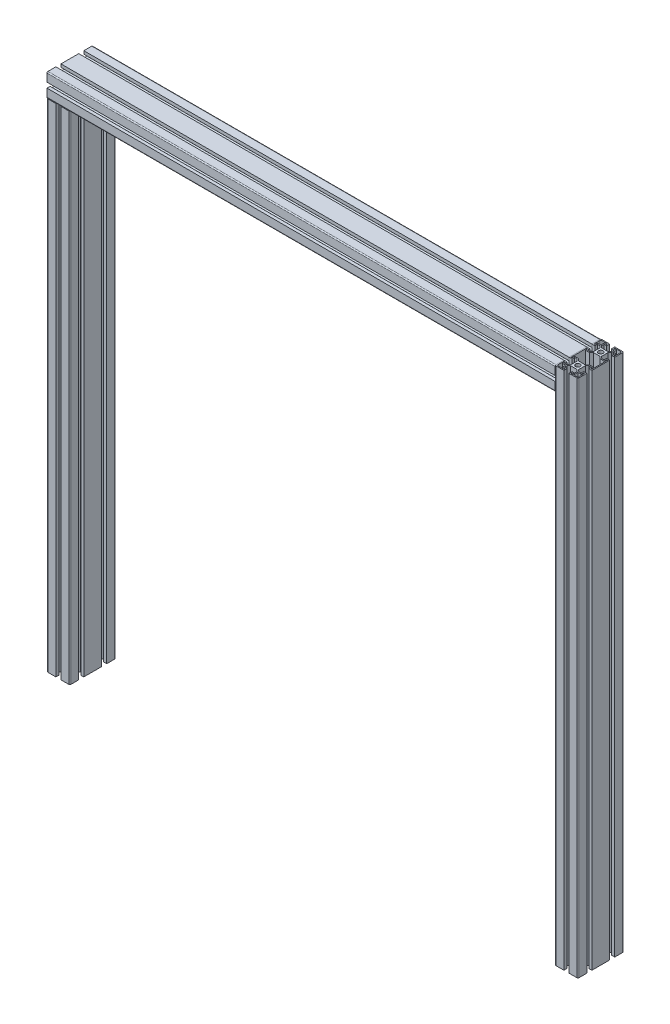
from build123d import *

# Parameters (mm, degrees)
PERFIL_ALUMINIO_45_X_90_1_DEPTH      = 1000
PERFIL_ALUMINIO_45_X_90_1_DEPTH_BACK = 22.5
SKETCH1_R                            = 4.5
SKETCH1_ON_SEGMENT_2_R               = 4.5
PERFIL_ALUMINIO_45_X_90_1_2_DEPTH    = 1022.5
SKETCH1_ON_SEGMENT_3_R               = 4.5
PERFIL_ALUMINIO_45_X_90_1_3_DEPTH    = 1002
BODY_START                           = 23.5
BODY_3_RUN_ON_DEPTH                  = 45


with BuildPart() as part:
    # Sketch1 → Perfil aluminio 45 X 90(1) (new, two sides: drawn at the far end of the back side and taken through both)
    with BuildSketch(Plane(origin=(1000, 1000, 0), x_dir=(1, 0, 0), z_dir=(0, -1, 0)).offset(-PERFIL_ALUMINIO_45_X_90_1_DEPTH_BACK)):
        with BuildLine():
            Line((-16.5, -27.5), (-22.5, -27.5))
            Line((-22.5, -27.5), (-22.5, -43))
            ThreePointArc((-22.5, -43), (-21.914213562, -44.414213562), (-20.5, -45))
            Line((-20.5, -45), (-5, -45))
            Line((-5, -45), (-5, -39))
            Line((-5, -39), (-10, -39))
            Line((-10, -39), (-10, -33.914213562))
            Line((-10, -33.914213562), (-6.585786438, -30.5))
            Line((-6.585786438, -30.5), (6.585786438, -30.5))
            Line((6.585786438, -30.5), (10, -33.914213562))
            Line((10, -33.914213562), (10, -39))
            Line((10, -39), (5, -39))
            Line((5, -39), (5, -45))
            Line((5, -45), (20.5, -45))
            ThreePointArc((20.5, -45), (21.914213562, -44.414213562), (22.5, -43))
            Line((22.5, -43), (22.5, -27.5))
            Line((22.5, -27.5), (16.5, -27.5))
            Line((16.5, -27.5), (16.5, -32.5))
            Line((16.5, -32.5), (11.414213562, -32.5))
            Line((11.414213562, -32.5), (8, -29.085786438))
            Line((8, -29.085786438), (8, -15.914213562))
            Line((8, -15.914213562), (11.414213562, -12.5))
            Line((11.414213562, -12.5), (16.5, -12.5))
            Line((16.5, -12.5), (16.5, -17.5))
            Line((16.5, -17.5), (22.5, -17.5))
            Line((22.5, -17.5), (22.5, 17.5))
            Line((22.5, 17.5), (16.5, 17.5))
            Line((16.5, 17.5), (16.5, 12.5))
            Line((16.5, 12.5), (11.414213562, 12.5))
            Line((11.414213562, 12.5), (8, 15.914213562))
            Line((8, 15.914213562), (8, 29.085786438))
            Line((8, 29.085786438), (11.414213562, 32.5))
            Line((11.414213562, 32.5), (16.5, 32.5))
            Line((16.5, 32.5), (16.5, 27.5))
            Line((16.5, 27.5), (22.5, 27.5))
            Line((22.5, 27.5), (22.5, 43))
            ThreePointArc((22.5, 43), (21.914213562, 44.414213562), (20.5, 45))
            Line((20.5, 45), (5, 45))
            Line((5, 45), (5, 39))
            Line((5, 39), (10, 39))
            Line((10, 39), (10, 33.914213562))
            Line((10, 33.914213562), (6.585786438, 30.5))
            Line((6.585786438, 30.5), (-6.585786438, 30.5))
            Line((-6.585786438, 30.5), (-10, 33.914213562))
            Line((-10, 33.914213562), (-10, 39))
            Line((-10, 39), (-5, 39))
            Line((-5, 39), (-5, 45))
            Line((-5, 45), (-20.5, 45))
            ThreePointArc((-20.5, 45), (-21.914213562, 44.414213562), (-22.5, 43))
            Line((-22.5, 43), (-22.5, 27.5))
            Line((-22.5, 27.5), (-16.5, 27.5))
            Line((-16.5, 27.5), (-16.5, 32.5))
            Line((-16.5, 32.5), (-11.414213562, 32.5))
            Line((-11.414213562, 32.5), (-8, 29.085786438))
            Line((-8, 29.085786438), (-8, 15.914213562))
            Line((-8, 15.914213562), (-11.414213562, 12.5))
            Line((-11.414213562, 12.5), (-16.5, 12.5))
            Line((-16.5, 12.5), (-16.5, 17.5))
            Line((-16.5, 17.5), (-22.5, 17.5))
            Line((-22.5, 17.5), (-22.5, -17.5))
            Line((-22.5, -17.5), (-16.5, -17.5))
            Line((-16.5, -17.5), (-16.5, -12.5))
            Line((-16.5, -12.5), (-11.414213562, -12.5))
            Line((-11.414213562, -12.5), (-8, -15.914213562))
            Line((-8, -15.914213562), (-8, -29.085786438))
            Line((-8, -29.085786438), (-11.414213562, -32.5))
            Line((-11.414213562, -32.5), (-16.5, -32.5))
            Line((-16.5, -32.5), (-16.5, -27.5))
        make_face()
        with Locations((0, -22.5)):
            Circle(SKETCH1_R, mode=Mode.SUBTRACT)
        with Locations((0, 22.5)):
            Circle(SKETCH1_R, mode=Mode.SUBTRACT)
        with BuildLine():
            Line((-20.5, -29.5), (-20.5, -41))
            ThreePointArc((-20.5, -41), (-19.914213562, -42.414213562), (-18.5, -43))
            Line((-18.5, -43), (-7, -43))
            Line((-7, -43), (-7, -41))
            Line((-7, -41), (-12, -41))
            Line((-12, -41), (-12, -34.5))
            Line((-12, -34.5), (-18.5, -34.5))
            Line((-18.5, -34.5), (-18.5, -29.5))
            Line((-18.5, -29.5), (-20.5, -29.5))
        make_face(mode=Mode.SUBTRACT)
        with BuildLine():
            Line((12, -41), (12, -34.5))
            Line((12, -34.5), (18.5, -34.5))
            Line((18.5, -34.5), (18.5, -29.5))
            Line((18.5, -29.5), (20.5, -29.5))
            Line((20.5, -29.5), (20.5, -41))
            ThreePointArc((20.5, -41), (19.914213562, -42.414213562), (18.5, -43))
            Line((18.5, -43), (7, -43))
            Line((7, -43), (7, -41))
            Line((7, -41), (12, -41))
        make_face(mode=Mode.SUBTRACT)
        Polygon((20.5, -2), (20.5, 2), (20.5, 15.5), (18.5, 15.5), (18.5, 10.5), (12, 10.5), (10.585786438, 10.5), (10, 11.085786438), (6.585786438, 14.5), (-6.585786438, 14.5), (-10, 11.085786438), (-10.585786438, 10.5), (-12, 10.5), (-18.5, 10.5), (-18.5, 15.5), (-20.5, 15.5), (-20.5, 2), (-20.5, -2), (-20.5, -15.5), (-18.5, -15.5), (-18.5, -10.5), (-12, -10.5), (-10.585786438, -10.5), (-10, -11.085786438), (-6.585786438, -14.5), (6.585786438, -14.5), (10, -11.085786438), (10.585786438, -10.5), (12, -10.5), (18.5, -10.5), (18.5, -15.5), (20.5, -15.5), align=None, mode=Mode.SUBTRACT)
        with BuildLine():
            Line((-12, 41), (-12, 34.5))
            Line((-12, 34.5), (-18.5, 34.5))
            Line((-18.5, 34.5), (-18.5, 29.5))
            Line((-18.5, 29.5), (-20.5, 29.5))
            Line((-20.5, 29.5), (-20.5, 41))
            ThreePointArc((-20.5, 41), (-19.914213562, 42.414213562), (-18.5, 43))
            Line((-18.5, 43), (-7, 43))
            Line((-7, 43), (-7, 41))
            Line((-7, 41), (-12, 41))
        make_face(mode=Mode.SUBTRACT)
        with BuildLine():
            Line((20.5, 29.5), (20.5, 41))
            ThreePointArc((20.5, 41), (19.914213562, 42.414213562), (18.5, 43))
            Line((18.5, 43), (7, 43))
            Line((7, 43), (7, 41))
            Line((7, 41), (12, 41))
            Line((12, 41), (12, 34.5))
            Line((12, 34.5), (18.5, 34.5))
            Line((18.5, 34.5), (18.5, 29.5))
            Line((18.5, 29.5), (20.5, 29.5))
        make_face(mode=Mode.SUBTRACT)
    extrude(amount=PERFIL_ALUMINIO_45_X_90_1_DEPTH + PERFIL_ALUMINIO_45_X_90_1_DEPTH_BACK)


with BuildPart() as body_2:
    # Sketch1 on segment 2 (carried to segment 2) → Perfil aluminio 45 X 90_1 2 (new body)
    with BuildSketch(Plane.XZ.offset(-1022.5)):
        with BuildLine():
            Line((-16.5, -27.5), (-22.5, -27.5))
            Line((-22.5, -27.5), (-22.5, -43))
            ThreePointArc((-22.5, -43), (-21.914213562, -44.414213562), (-20.5, -45))
            Line((-20.5, -45), (-5, -45))
            Line((-5, -45), (-5, -39))
            Line((-5, -39), (-10, -39))
            Line((-10, -39), (-10, -33.914213562))
            Line((-10, -33.914213562), (-6.585786438, -30.5))
            Line((-6.585786438, -30.5), (6.585786438, -30.5))
            Line((6.585786438, -30.5), (10, -33.914213562))
            Line((10, -33.914213562), (10, -39))
            Line((10, -39), (5, -39))
            Line((5, -39), (5, -45))
            Line((5, -45), (20.5, -45))
            ThreePointArc((20.5, -45), (21.914213562, -44.414213562), (22.5, -43))
            Line((22.5, -43), (22.5, -27.5))
            Line((22.5, -27.5), (16.5, -27.5))
            Line((16.5, -27.5), (16.5, -32.5))
            Line((16.5, -32.5), (11.414213562, -32.5))
            Line((11.414213562, -32.5), (8, -29.085786438))
            Line((8, -29.085786438), (8, -15.914213562))
            Line((8, -15.914213562), (11.414213562, -12.5))
            Line((11.414213562, -12.5), (16.5, -12.5))
            Line((16.5, -12.5), (16.5, -17.5))
            Line((16.5, -17.5), (22.5, -17.5))
            Line((22.5, -17.5), (22.5, 17.5))
            Line((22.5, 17.5), (16.5, 17.5))
            Line((16.5, 17.5), (16.5, 12.5))
            Line((16.5, 12.5), (11.414213562, 12.5))
            Line((11.414213562, 12.5), (8, 15.914213562))
            Line((8, 15.914213562), (8, 29.085786438))
            Line((8, 29.085786438), (11.414213562, 32.5))
            Line((11.414213562, 32.5), (16.5, 32.5))
            Line((16.5, 32.5), (16.5, 27.5))
            Line((16.5, 27.5), (22.5, 27.5))
            Line((22.5, 27.5), (22.5, 43))
            ThreePointArc((22.5, 43), (21.914213562, 44.414213562), (20.5, 45))
            Line((20.5, 45), (5, 45))
            Line((5, 45), (5, 39))
            Line((5, 39), (10, 39))
            Line((10, 39), (10, 33.914213562))
            Line((10, 33.914213562), (6.585786438, 30.5))
            Line((6.585786438, 30.5), (-6.585786438, 30.5))
            Line((-6.585786438, 30.5), (-10, 33.914213562))
            Line((-10, 33.914213562), (-10, 39))
            Line((-10, 39), (-5, 39))
            Line((-5, 39), (-5, 45))
            Line((-5, 45), (-20.5, 45))
            ThreePointArc((-20.5, 45), (-21.914213562, 44.414213562), (-22.5, 43))
            Line((-22.5, 43), (-22.5, 27.5))
            Line((-22.5, 27.5), (-16.5, 27.5))
            Line((-16.5, 27.5), (-16.5, 32.5))
            Line((-16.5, 32.5), (-11.414213562, 32.5))
            Line((-11.414213562, 32.5), (-8, 29.085786438))
            Line((-8, 29.085786438), (-8, 15.914213562))
            Line((-8, 15.914213562), (-11.414213562, 12.5))
            Line((-11.414213562, 12.5), (-16.5, 12.5))
            Line((-16.5, 12.5), (-16.5, 17.5))
            Line((-16.5, 17.5), (-22.5, 17.5))
            Line((-22.5, 17.5), (-22.5, -17.5))
            Line((-22.5, -17.5), (-16.5, -17.5))
            Line((-16.5, -17.5), (-16.5, -12.5))
            Line((-16.5, -12.5), (-11.414213562, -12.5))
            Line((-11.414213562, -12.5), (-8, -15.914213562))
            Line((-8, -15.914213562), (-8, -29.085786438))
            Line((-8, -29.085786438), (-11.414213562, -32.5))
            Line((-11.414213562, -32.5), (-16.5, -32.5))
            Line((-16.5, -32.5), (-16.5, -27.5))
        make_face()
        with Locations((0, -22.5)):
            Circle(SKETCH1_ON_SEGMENT_2_R, mode=Mode.SUBTRACT)
        with Locations((0, 22.5)):
            Circle(SKETCH1_ON_SEGMENT_2_R, mode=Mode.SUBTRACT)
        with BuildLine():
            Line((-20.5, -29.5), (-20.5, -41))
            ThreePointArc((-20.5, -41), (-19.914213562, -42.414213562), (-18.5, -43))
            Line((-18.5, -43), (-7, -43))
            Line((-7, -43), (-7, -41))
            Line((-7, -41), (-12, -41))
            Line((-12, -41), (-12, -34.5))
            Line((-12, -34.5), (-18.5, -34.5))
            Line((-18.5, -34.5), (-18.5, -29.5))
            Line((-18.5, -29.5), (-20.5, -29.5))
        make_face(mode=Mode.SUBTRACT)
        with BuildLine():
            Line((12, -41), (12, -34.5))
            Line((12, -34.5), (18.5, -34.5))
            Line((18.5, -34.5), (18.5, -29.5))
            Line((18.5, -29.5), (20.5, -29.5))
            Line((20.5, -29.5), (20.5, -41))
            ThreePointArc((20.5, -41), (19.914213562, -42.414213562), (18.5, -43))
            Line((18.5, -43), (7, -43))
            Line((7, -43), (7, -41))
            Line((7, -41), (12, -41))
        make_face(mode=Mode.SUBTRACT)
        Polygon((20.5, -2), (20.5, 2), (20.5, 15.5), (18.5, 15.5), (18.5, 10.5), (12, 10.5), (10.585786438, 10.5), (10, 11.085786438), (6.585786438, 14.5), (-6.585786438, 14.5), (-10, 11.085786438), (-10.585786438, 10.5), (-12, 10.5), (-18.5, 10.5), (-18.5, 15.5), (-20.5, 15.5), (-20.5, 2), (-20.5, -2), (-20.5, -15.5), (-18.5, -15.5), (-18.5, -10.5), (-12, -10.5), (-10.585786438, -10.5), (-10, -11.085786438), (-6.585786438, -14.5), (6.585786438, -14.5), (10, -11.085786438), (10.585786438, -10.5), (12, -10.5), (18.5, -10.5), (18.5, -15.5), (20.5, -15.5), align=None, mode=Mode.SUBTRACT)
        with BuildLine():
            Line((-12, 41), (-12, 34.5))
            Line((-12, 34.5), (-18.5, 34.5))
            Line((-18.5, 34.5), (-18.5, 29.5))
            Line((-18.5, 29.5), (-20.5, 29.5))
            Line((-20.5, 29.5), (-20.5, 41))
            ThreePointArc((-20.5, 41), (-19.914213562, 42.414213562), (-18.5, 43))
            Line((-18.5, 43), (-7, 43))
            Line((-7, 43), (-7, 41))
            Line((-7, 41), (-12, 41))
        make_face(mode=Mode.SUBTRACT)
        with BuildLine():
            Line((20.5, 29.5), (20.5, 41))
            ThreePointArc((20.5, 41), (19.914213562, 42.414213562), (18.5, 43))
            Line((18.5, 43), (7, 43))
            Line((7, 43), (7, 41))
            Line((7, 41), (12, 41))
            Line((12, 41), (12, 34.5))
            Line((12, 34.5), (18.5, 34.5))
            Line((18.5, 34.5), (18.5, 29.5))
            Line((18.5, 29.5), (20.5, 29.5))
        make_face(mode=Mode.SUBTRACT)
    extrude(amount=PERFIL_ALUMINIO_45_X_90_1_2_DEPTH)

    # Trim_Extend1 3
    split(bisect_by=Plane(origin=(500, 977.5, 0), x_dir=(1, 0, 0), z_dir=(0, -1, 0)), keep=Keep.TOP)


with BuildPart() as body_3:
    # Sketch1 on segment 3 (carried to segment 3) → Perfil aluminio 45 X 90_1 3 (new body)
    with BuildSketch(Plane(origin=(-1, 1000, 0), x_dir=(0, 1, 0), z_dir=(1, 0, 0))):
        with BuildLine():
            Line((-16.5, -27.5), (-22.5, -27.5))
            Line((-22.5, -27.5), (-22.5, -43))
            ThreePointArc((-22.5, -43), (-21.914213562, -44.414213562), (-20.5, -45))
            Line((-20.5, -45), (-5, -45))
            Line((-5, -45), (-5, -39))
            Line((-5, -39), (-10, -39))
            Line((-10, -39), (-10, -33.914213562))
            Line((-10, -33.914213562), (-6.585786438, -30.5))
            Line((-6.585786438, -30.5), (6.585786438, -30.5))
            Line((6.585786438, -30.5), (10, -33.914213562))
            Line((10, -33.914213562), (10, -39))
            Line((10, -39), (5, -39))
            Line((5, -39), (5, -45))
            Line((5, -45), (20.5, -45))
            ThreePointArc((20.5, -45), (21.914213562, -44.414213562), (22.5, -43))
            Line((22.5, -43), (22.5, -27.5))
            Line((22.5, -27.5), (16.5, -27.5))
            Line((16.5, -27.5), (16.5, -32.5))
            Line((16.5, -32.5), (11.414213562, -32.5))
            Line((11.414213562, -32.5), (8, -29.085786438))
            Line((8, -29.085786438), (8, -15.914213562))
            Line((8, -15.914213562), (11.414213562, -12.5))
            Line((11.414213562, -12.5), (16.5, -12.5))
            Line((16.5, -12.5), (16.5, -17.5))
            Line((16.5, -17.5), (22.5, -17.5))
            Line((22.5, -17.5), (22.5, 17.5))
            Line((22.5, 17.5), (16.5, 17.5))
            Line((16.5, 17.5), (16.5, 12.5))
            Line((16.5, 12.5), (11.414213562, 12.5))
            Line((11.414213562, 12.5), (8, 15.914213562))
            Line((8, 15.914213562), (8, 29.085786438))
            Line((8, 29.085786438), (11.414213562, 32.5))
            Line((11.414213562, 32.5), (16.5, 32.5))
            Line((16.5, 32.5), (16.5, 27.5))
            Line((16.5, 27.5), (22.5, 27.5))
            Line((22.5, 27.5), (22.5, 43))
            ThreePointArc((22.5, 43), (21.914213562, 44.414213562), (20.5, 45))
            Line((20.5, 45), (5, 45))
            Line((5, 45), (5, 39))
            Line((5, 39), (10, 39))
            Line((10, 39), (10, 33.914213562))
            Line((10, 33.914213562), (6.585786438, 30.5))
            Line((6.585786438, 30.5), (-6.585786438, 30.5))
            Line((-6.585786438, 30.5), (-10, 33.914213562))
            Line((-10, 33.914213562), (-10, 39))
            Line((-10, 39), (-5, 39))
            Line((-5, 39), (-5, 45))
            Line((-5, 45), (-20.5, 45))
            ThreePointArc((-20.5, 45), (-21.914213562, 44.414213562), (-22.5, 43))
            Line((-22.5, 43), (-22.5, 27.5))
            Line((-22.5, 27.5), (-16.5, 27.5))
            Line((-16.5, 27.5), (-16.5, 32.5))
            Line((-16.5, 32.5), (-11.414213562, 32.5))
            Line((-11.414213562, 32.5), (-8, 29.085786438))
            Line((-8, 29.085786438), (-8, 15.914213562))
            Line((-8, 15.914213562), (-11.414213562, 12.5))
            Line((-11.414213562, 12.5), (-16.5, 12.5))
            Line((-16.5, 12.5), (-16.5, 17.5))
            Line((-16.5, 17.5), (-22.5, 17.5))
            Line((-22.5, 17.5), (-22.5, -17.5))
            Line((-22.5, -17.5), (-16.5, -17.5))
            Line((-16.5, -17.5), (-16.5, -12.5))
            Line((-16.5, -12.5), (-11.414213562, -12.5))
            Line((-11.414213562, -12.5), (-8, -15.914213562))
            Line((-8, -15.914213562), (-8, -29.085786438))
            Line((-8, -29.085786438), (-11.414213562, -32.5))
            Line((-11.414213562, -32.5), (-16.5, -32.5))
            Line((-16.5, -32.5), (-16.5, -27.5))
        make_face()
        with Locations((0, -22.5)):
            Circle(SKETCH1_ON_SEGMENT_3_R, mode=Mode.SUBTRACT)
        with Locations((0, 22.5)):
            Circle(SKETCH1_ON_SEGMENT_3_R, mode=Mode.SUBTRACT)
        with BuildLine():
            Line((-20.5, -29.5), (-20.5, -41))
            ThreePointArc((-20.5, -41), (-19.914213562, -42.414213562), (-18.5, -43))
            Line((-18.5, -43), (-7, -43))
            Line((-7, -43), (-7, -41))
            Line((-7, -41), (-12, -41))
            Line((-12, -41), (-12, -34.5))
            Line((-12, -34.5), (-18.5, -34.5))
            Line((-18.5, -34.5), (-18.5, -29.5))
            Line((-18.5, -29.5), (-20.5, -29.5))
        make_face(mode=Mode.SUBTRACT)
        with BuildLine():
            Line((12, -41), (12, -34.5))
            Line((12, -34.5), (18.5, -34.5))
            Line((18.5, -34.5), (18.5, -29.5))
            Line((18.5, -29.5), (20.5, -29.5))
            Line((20.5, -29.5), (20.5, -41))
            ThreePointArc((20.5, -41), (19.914213562, -42.414213562), (18.5, -43))
            Line((18.5, -43), (7, -43))
            Line((7, -43), (7, -41))
            Line((7, -41), (12, -41))
        make_face(mode=Mode.SUBTRACT)
        Polygon((20.5, -2), (20.5, 2), (20.5, 15.5), (18.5, 15.5), (18.5, 10.5), (12, 10.5), (10.585786438, 10.5), (10, 11.085786438), (6.585786438, 14.5), (-6.585786438, 14.5), (-10, 11.085786438), (-10.585786438, 10.5), (-12, 10.5), (-18.5, 10.5), (-18.5, 15.5), (-20.5, 15.5), (-20.5, 2), (-20.5, -2), (-20.5, -15.5), (-18.5, -15.5), (-18.5, -10.5), (-12, -10.5), (-10.585786438, -10.5), (-10, -11.085786438), (-6.585786438, -14.5), (6.585786438, -14.5), (10, -11.085786438), (10.585786438, -10.5), (12, -10.5), (18.5, -10.5), (18.5, -15.5), (20.5, -15.5), align=None, mode=Mode.SUBTRACT)
        with BuildLine():
            Line((-12, 41), (-12, 34.5))
            Line((-12, 34.5), (-18.5, 34.5))
            Line((-18.5, 34.5), (-18.5, 29.5))
            Line((-18.5, 29.5), (-20.5, 29.5))
            Line((-20.5, 29.5), (-20.5, 41))
            ThreePointArc((-20.5, 41), (-19.914213562, 42.414213562), (-18.5, 43))
            Line((-18.5, 43), (-7, 43))
            Line((-7, 43), (-7, 41))
            Line((-7, 41), (-12, 41))
        make_face(mode=Mode.SUBTRACT)
        with BuildLine():
            Line((20.5, 29.5), (20.5, 41))
            ThreePointArc((20.5, 41), (19.914213562, 42.414213562), (18.5, 43))
            Line((18.5, 43), (7, 43))
            Line((7, 43), (7, 41))
            Line((7, 41), (12, 41))
            Line((12, 41), (12, 34.5))
            Line((12, 34.5), (18.5, 34.5))
            Line((18.5, 34.5), (18.5, 29.5))
            Line((18.5, 29.5), (20.5, 29.5))
        make_face(mode=Mode.SUBTRACT)
    extrude(amount=PERFIL_ALUMINIO_45_X_90_1_3_DEPTH)

    # Perfil aluminio 45 X 90_1 3 end butt 1
    split(bisect_by=Plane(origin=(22.5, 1000, 0), x_dir=(0, 1, 0), z_dir=(1, 0, 0)), keep=Keep.TOP)

    # Perfil aluminio 45 X 90_1 3 end butt 2
    split(bisect_by=Plane(origin=(977.5, 1000, 0), x_dir=(0, -1, 0), z_dir=(-1, 0, 0)), keep=Keep.TOP)

    # Sketch1 on segment 3 (carried to segment 3) → body 3 run on (add)
    with BuildSketch(Plane(origin=(-1, 1000, 0), x_dir=(0, 1, 0), z_dir=(1, 0, 0)).offset(BODY_START)):
        with BuildLine():
            Line((-16.5, -27.5), (-22.5, -27.5))
            Line((-22.5, -27.5), (-22.5, -43))
            ThreePointArc((-22.5, -43), (-21.914213562, -44.414213562), (-20.5, -45))
            Line((-20.5, -45), (-5, -45))
            Line((-5, -45), (-5, -39))
            Line((-5, -39), (-10, -39))
            Line((-10, -39), (-10, -33.914213562))
            Line((-10, -33.914213562), (-6.585786438, -30.5))
            Line((-6.585786438, -30.5), (6.585786438, -30.5))
            Line((6.585786438, -30.5), (10, -33.914213562))
            Line((10, -33.914213562), (10, -39))
            Line((10, -39), (5, -39))
            Line((5, -39), (5, -45))
            Line((5, -45), (20.5, -45))
            ThreePointArc((20.5, -45), (21.914213562, -44.414213562), (22.5, -43))
            Line((22.5, -43), (22.5, -27.5))
            Line((22.5, -27.5), (16.5, -27.5))
            Line((16.5, -27.5), (16.5, -32.5))
            Line((16.5, -32.5), (11.414213562, -32.5))
            Line((11.414213562, -32.5), (8, -29.085786438))
            Line((8, -29.085786438), (8, -15.914213562))
            Line((8, -15.914213562), (11.414213562, -12.5))
            Line((11.414213562, -12.5), (16.5, -12.5))
            Line((16.5, -12.5), (16.5, -17.5))
            Line((16.5, -17.5), (22.5, -17.5))
            Line((22.5, -17.5), (22.5, 17.5))
            Line((22.5, 17.5), (16.5, 17.5))
            Line((16.5, 17.5), (16.5, 12.5))
            Line((16.5, 12.5), (11.414213562, 12.5))
            Line((11.414213562, 12.5), (8, 15.914213562))
            Line((8, 15.914213562), (8, 29.085786438))
            Line((8, 29.085786438), (11.414213562, 32.5))
            Line((11.414213562, 32.5), (16.5, 32.5))
            Line((16.5, 32.5), (16.5, 27.5))
            Line((16.5, 27.5), (22.5, 27.5))
            Line((22.5, 27.5), (22.5, 43))
            ThreePointArc((22.5, 43), (21.914213562, 44.414213562), (20.5, 45))
            Line((20.5, 45), (5, 45))
            Line((5, 45), (5, 39))
            Line((5, 39), (10, 39))
            Line((10, 39), (10, 33.914213562))
            Line((10, 33.914213562), (6.585786438, 30.5))
            Line((6.585786438, 30.5), (-6.585786438, 30.5))
            Line((-6.585786438, 30.5), (-10, 33.914213562))
            Line((-10, 33.914213562), (-10, 39))
            Line((-10, 39), (-5, 39))
            Line((-5, 39), (-5, 45))
            Line((-5, 45), (-20.5, 45))
            ThreePointArc((-20.5, 45), (-21.914213562, 44.414213562), (-22.5, 43))
            Line((-22.5, 43), (-22.5, 27.5))
            Line((-22.5, 27.5), (-16.5, 27.5))
            Line((-16.5, 27.5), (-16.5, 32.5))
            Line((-16.5, 32.5), (-11.414213562, 32.5))
            Line((-11.414213562, 32.5), (-8, 29.085786438))
            Line((-8, 29.085786438), (-8, 15.914213562))
            Line((-8, 15.914213562), (-11.414213562, 12.5))
            Line((-11.414213562, 12.5), (-16.5, 12.5))
            Line((-16.5, 12.5), (-16.5, 17.5))
            Line((-16.5, 17.5), (-22.5, 17.5))
            Line((-22.5, 17.5), (-22.5, -17.5))
            Line((-22.5, -17.5), (-16.5, -17.5))
            Line((-16.5, -17.5), (-16.5, -12.5))
            Line((-16.5, -12.5), (-11.414213562, -12.5))
            Line((-11.414213562, -12.5), (-8, -15.914213562))
            Line((-8, -15.914213562), (-8, -29.085786438))
            Line((-8, -29.085786438), (-11.414213562, -32.5))
            Line((-11.414213562, -32.5), (-16.5, -32.5))
            Line((-16.5, -32.5), (-16.5, -27.5))
        make_face()
        with Locations((0, -22.5)):
            Circle(SKETCH1_ON_SEGMENT_3_R, mode=Mode.SUBTRACT)
        with Locations((0, 22.5)):
            Circle(SKETCH1_ON_SEGMENT_3_R, mode=Mode.SUBTRACT)
        with BuildLine():
            Line((-20.5, -29.5), (-20.5, -41))
            ThreePointArc((-20.5, -41), (-19.914213562, -42.414213562), (-18.5, -43))
            Line((-18.5, -43), (-7, -43))
            Line((-7, -43), (-7, -41))
            Line((-7, -41), (-12, -41))
            Line((-12, -41), (-12, -34.5))
            Line((-12, -34.5), (-18.5, -34.5))
            Line((-18.5, -34.5), (-18.5, -29.5))
            Line((-18.5, -29.5), (-20.5, -29.5))
        make_face(mode=Mode.SUBTRACT)
        with BuildLine():
            Line((12, -41), (12, -34.5))
            Line((12, -34.5), (18.5, -34.5))
            Line((18.5, -34.5), (18.5, -29.5))
            Line((18.5, -29.5), (20.5, -29.5))
            Line((20.5, -29.5), (20.5, -41))
            ThreePointArc((20.5, -41), (19.914213562, -42.414213562), (18.5, -43))
            Line((18.5, -43), (7, -43))
            Line((7, -43), (7, -41))
            Line((7, -41), (12, -41))
        make_face(mode=Mode.SUBTRACT)
        Polygon((20.5, -2), (20.5, 2), (20.5, 15.5), (18.5, 15.5), (18.5, 10.5), (12, 10.5), (10.585786438, 10.5), (10, 11.085786438), (6.585786438, 14.5), (-6.585786438, 14.5), (-10, 11.085786438), (-10.585786438, 10.5), (-12, 10.5), (-18.5, 10.5), (-18.5, 15.5), (-20.5, 15.5), (-20.5, 2), (-20.5, -2), (-20.5, -15.5), (-18.5, -15.5), (-18.5, -10.5), (-12, -10.5), (-10.585786438, -10.5), (-10, -11.085786438), (-6.585786438, -14.5), (6.585786438, -14.5), (10, -11.085786438), (10.585786438, -10.5), (12, -10.5), (18.5, -10.5), (18.5, -15.5), (20.5, -15.5), align=None, mode=Mode.SUBTRACT)
        with BuildLine():
            Line((-12, 41), (-12, 34.5))
            Line((-12, 34.5), (-18.5, 34.5))
            Line((-18.5, 34.5), (-18.5, 29.5))
            Line((-18.5, 29.5), (-20.5, 29.5))
            Line((-20.5, 29.5), (-20.5, 41))
            ThreePointArc((-20.5, 41), (-19.914213562, 42.414213562), (-18.5, 43))
            Line((-18.5, 43), (-7, 43))
            Line((-7, 43), (-7, 41))
            Line((-7, 41), (-12, 41))
        make_face(mode=Mode.SUBTRACT)
        with BuildLine():
            Line((20.5, 29.5), (20.5, 41))
            ThreePointArc((20.5, 41), (19.914213562, 42.414213562), (18.5, 43))
            Line((18.5, 43), (7, 43))
            Line((7, 43), (7, 41))
            Line((7, 41), (12, 41))
            Line((12, 41), (12, 34.5))
            Line((12, 34.5), (18.5, 34.5))
            Line((18.5, 34.5), (18.5, 29.5))
            Line((18.5, 29.5), (20.5, 29.5))
        make_face(mode=Mode.SUBTRACT)
    extrude(amount=-BODY_3_RUN_ON_DEPTH)


solid = Compound([part.part, body_2.part, body_3.part])
